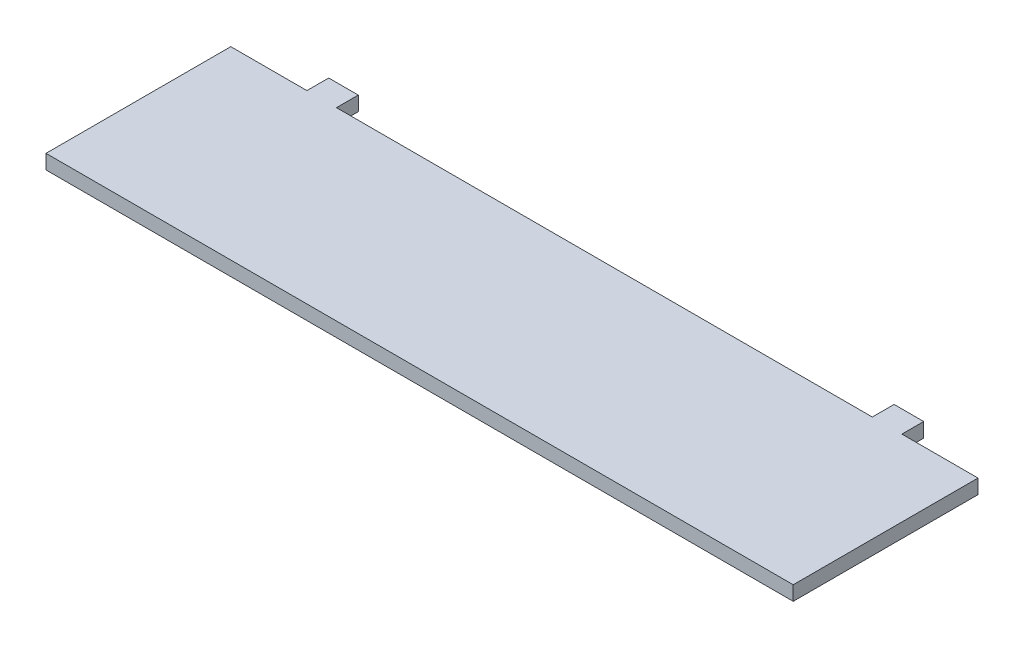
from build123d import *

# Parameters (mm, degrees)
SKETCH1_W           = 101.092
SKETCH1_H           = 25
BOSS_EXTRUDE1_DEPTH = 1.95
SKETCH2_W           = 4
SKETCH2_H           = 1.95
BOSS_EXTRUDE2_DEPTH = 2.95


with BuildPart() as part:
    # Sketch1 → Boss-Extrude1 (new body)
    with BuildSketch(Plane(origin=(0, 0, 0), x_dir=(1, 0, 0), z_dir=(0, 1, 0))):
        with Locations((8.554634564, 3.878326048)):
            Rectangle(SKETCH1_W, SKETCH1_H)
    extrude(amount=BOSS_EXTRUDE1_DEPTH)

    # Sketch2 → Boss-Extrude2 (add)
    with BuildSketch(Plane(origin=(0, 0, -16.378326048), x_dir=(-1, 0, 0), z_dir=(0, 0, -1))):
        with Locations((29.69374482, 0.975)):
            Rectangle(SKETCH2_W, SKETCH2_H)
        with Locations((-46.802134564, 0.975)):
            Rectangle(SKETCH2_W, SKETCH2_H)
    extrude(amount=BOSS_EXTRUDE2_DEPTH)


solid = part.part
